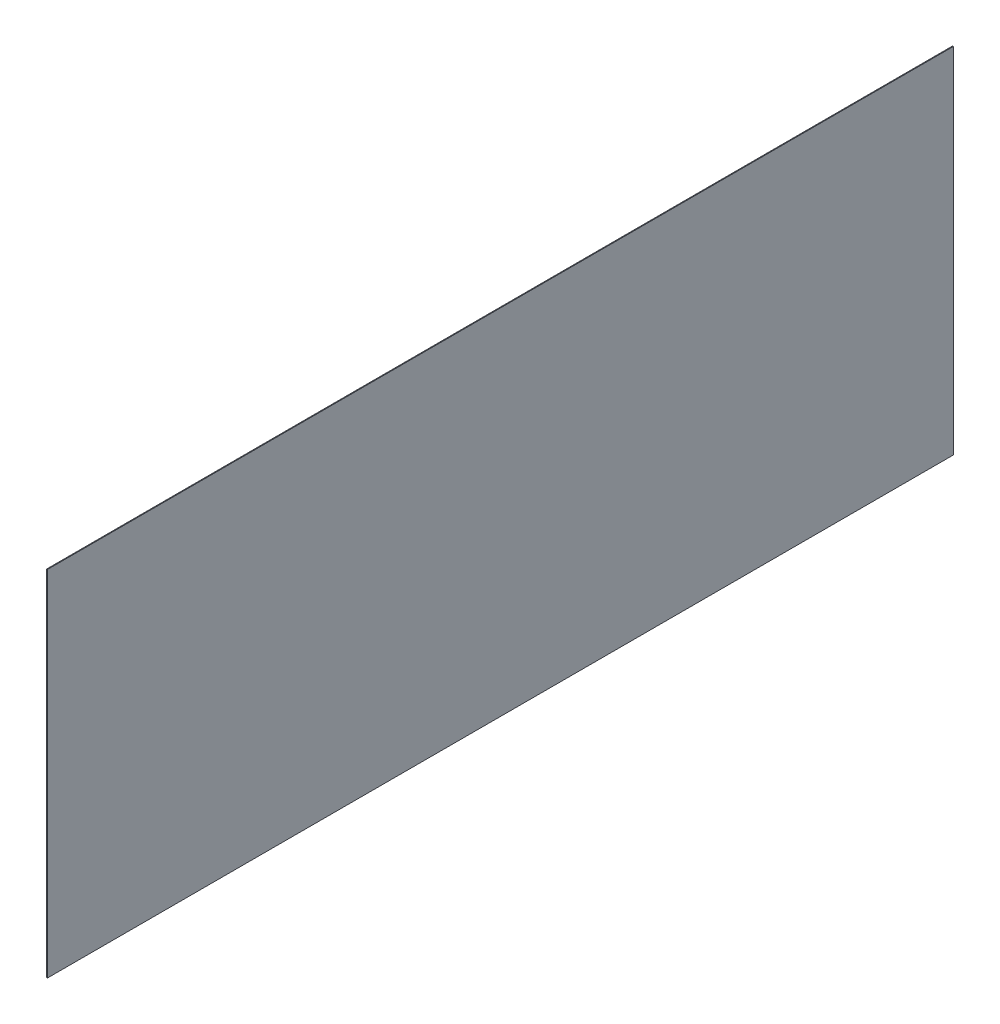
from build123d import *

# Parameters (mm, degrees)
SKETCH1_W           = 5752
SKETCH1_H           = 2247
BOSS_EXTRUDE1_DEPTH = 5


with BuildPart() as part:
    # Sketch1 → Boss-Extrude1 (new body)
    with BuildSketch(Plane(origin=(0, 0, 0), x_dir=(0, 0, -1), z_dir=(1, 0, 0))):
        Rectangle(SKETCH1_W, SKETCH1_H)
    extrude(amount=BOSS_EXTRUDE1_DEPTH)


solid = part.part
